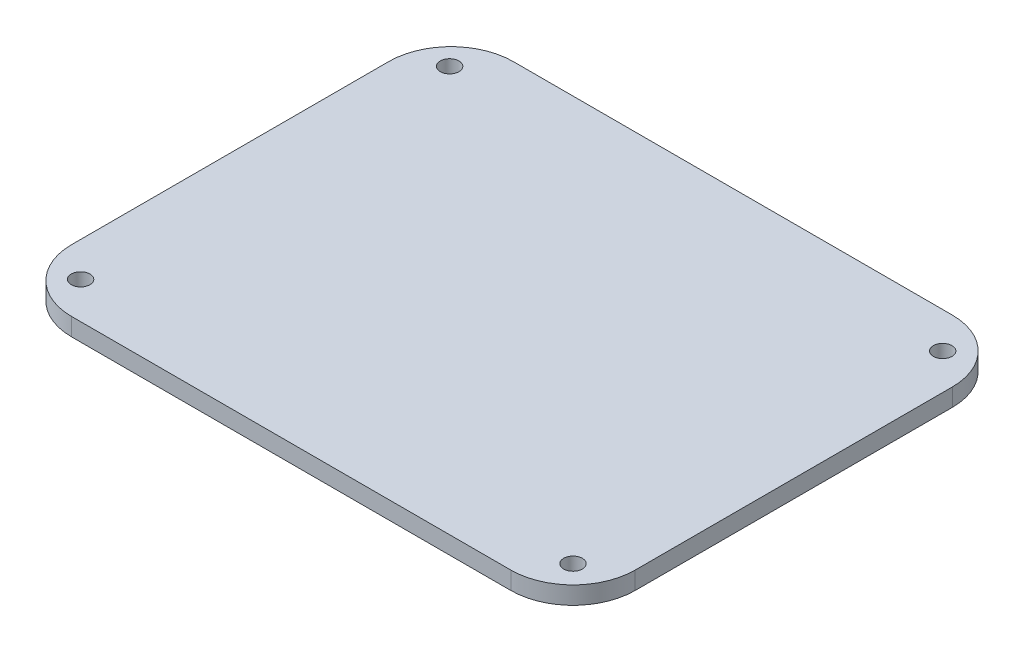
from build123d import *

# Parameters (mm, degrees)
SKETCH1_R           = 1.35
BOSS_EXTRUDE1_DEPTH = 2.56


with BuildPart() as part:
    # Sketch1 → Boss-Extrude1 (new body)
    with BuildSketch(Plane(origin=(0, 0, 0), x_dir=(1, 0, 0), z_dir=(0, 1, 0))):
        with BuildLine():
            Line((9, 0), (72.53, 0))
            ThreePointArc((72.53, 0), (78.893961031, 2.636038969), (81.53, 9))
            Line((81.53, 9), (81.53, 54.88))
            ThreePointArc((81.53, 54.88), (78.893961031, 61.243961031), (72.53, 63.88))
            Line((72.53, 63.88), (9, 63.88))
            ThreePointArc((9, 63.88), (2.636038969, 61.243961031), (0, 54.88))
            Line((0, 54.88), (0, 9))
            ThreePointArc((0, 9), (2.636038969, 2.636038969), (9, 0))
        make_face()
        with Locations(Location((5, 5.3, 0), (0, 0, 90))):
            Circle(SKETCH1_R, mode=Mode.SUBTRACT)
        with Locations(Location((5, 58.68, 0), (0, 0, 90))):
            Circle(SKETCH1_R, mode=Mode.SUBTRACT)
        with Locations(Location((76.33, 58.68, 0), (0, 0, 90))):
            Circle(SKETCH1_R, mode=Mode.SUBTRACT)
        with Locations(Location((76.23, 5.3, 0), (0, 0, 90))):
            Circle(SKETCH1_R, mode=Mode.SUBTRACT)
    extrude(amount=BOSS_EXTRUDE1_DEPTH)


solid = part.part
